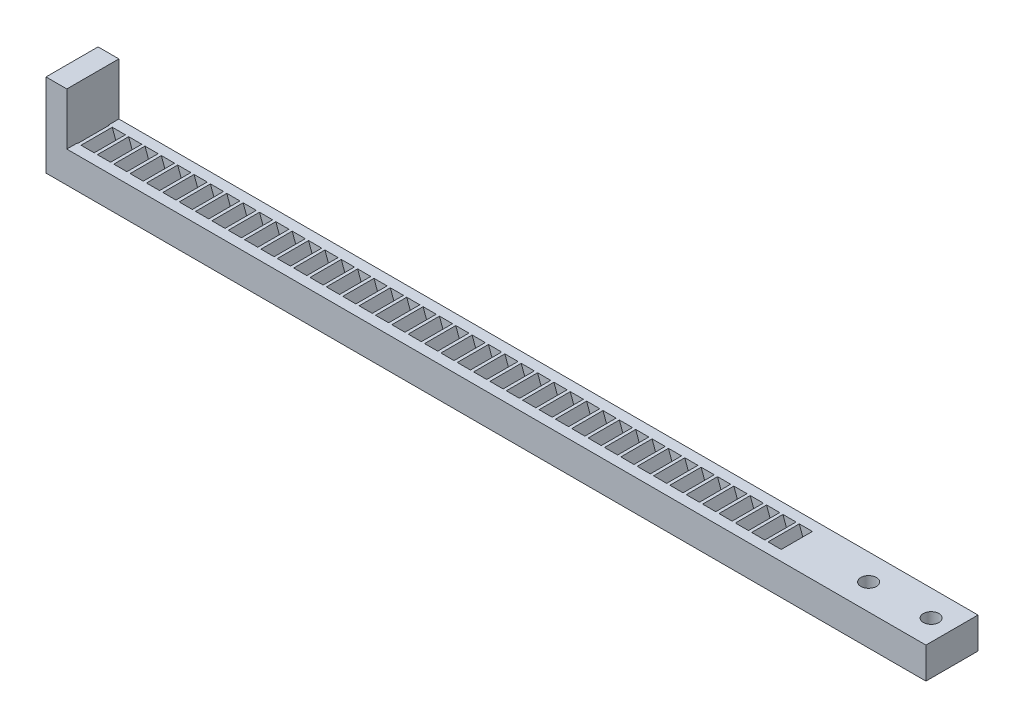
from build123d import *

# Parameters (mm, degrees)
BLANKSKE_W             = 185
BLANKSKE_H             = 6
BLANK_DEPTH            = 6
TOOTHCUTILL_DEPTH      = 186.194492359
TOOTHCUTSIM_DEPTH      = 186.194492359
PATTERN_LINEAR_1_COUNT = 50
PATTERN_LINEAR_1_PITCH = 3.14159265
SKETCH_3_W             = 6
SKETCH_3_H             = 6
CUT_EXTRUDE_1_DEPTH    = 16
SKETCH_2_W             = 2
SKETCH_2_H             = 6
EXTRUDE_2_DEPTH        = 169
CUT_EXTRUDE_2_DEPTH    = 150
SKETCH_5_W             = 10
SKETCH_5_H             = 16
EXTRUDE_3_DEPTH        = 4
SKETCH_6_R             = 1.5
CUT_EXTRUDE_3_DEPTH    = 186.442713526


with BuildPart() as part:
    # BlankSke → Blank (new body)
    with BuildSketch(Plane.XY):
        with Locations((92.5, 3)):
            Rectangle(BLANKSKE_W, BLANKSKE_H)
    extrude(amount=-BLANK_DEPTH)

    # TooCutSkeIll → ToothCutIll (cut, through all)
    with BuildSketch(Plane.XY):
        with BuildLine():
            Line((-1.253788993, 5.973680806), (-0.504546125, 3.915152944))
            ThreePointArc((-0.504546125, 3.915152944), (-0.412650963, 3.795392837), (-0.268683278, 3.75))
            Line((-0.268683278, 3.75), (0.268683278, 3.75))
            ThreePointArc((0.268683278, 3.75), (0.412650963, 3.795392837), (0.504546125, 3.915152944))
            Line((0.504546125, 3.915152944), (1.253788993, 5.973680806))
            ThreePointArc((1.253788993, 5.973680806), (1.268433641, 5.992766082), (1.291376698, 6))
            Line((1.291376698, 6), (1.291376698, 6.0254))
            Line((1.291376698, 6.0254), (-1.291376698, 6.0254))
            Line((-1.291376698, 6.0254), (-1.291376698, 6))
            ThreePointArc((-1.291376698, 6), (-1.268433641, 5.992766082), (-1.253788993, 5.973680806))
        make_face()
    extrude(amount=-TOOTHCUTILL_DEPTH, mode=Mode.SUBTRACT)

    # TooCutSkeSim → ToothCutSim (cut, through all)
    with BuildSketch(Plane.XY):
        Polygon((0.44443537, 3.75), (-0.44443537, 3.75), (-1.272613241, 6.0254), (1.272613241, 6.0254), align=None)
    toothcutsim = extrude(amount=-TOOTHCUTSIM_DEPTH, mode=Mode.SUBTRACT)

    # Линейный массив1: ToothCutSim ×50
    with Locations(*[(i * PATTERN_LINEAR_1_PITCH, 0, 0) for i in range(1, PATTERN_LINEAR_1_COUNT)]):
        add(toothcutsim, mode=Mode.SUBTRACT)

    # Эскиз3 → Вырез-Вытянуть1 (cut)
    with BuildSketch(Plane.ZY):
        with Locations((-3, 3)):
            Rectangle(SKETCH_3_W, SKETCH_3_H)
    extrude(amount=-CUT_EXTRUDE_1_DEPTH, mode=Mode.SUBTRACT)

    # Эскиз2 → Бобышка-Вытянуть2 (add)
    with BuildSketch(Plane(origin=(185, 0, 0), x_dir=(0, 0, -1), z_dir=(1, 0, 0))):
        with Locations((7, 3)):
            Rectangle(SKETCH_2_W, SKETCH_2_H)
        with Locations((-1, 3)):
            Rectangle(SKETCH_2_W, SKETCH_2_H)
    extrude(amount=-EXTRUDE_2_DEPTH)

    # Эскиз4 → Вырез-Вытянуть2 (cut)
    with BuildSketch(Plane.ZY.offset(-16)):
        with BuildLine():
            Line((-4.6, 1.6), (-4.6, 0))
            Line((-4.6, 0), (-1.4, 0))
            Line((-1.4, 0), (-1.4, 1.6))
            ThreePointArc((-1.4, 1.6), (-3, 3.2), (-4.6, 1.6))
        make_face()
    extrude(amount=-CUT_EXTRUDE_2_DEPTH, mode=Mode.SUBTRACT)

    # Эскиз5 → Бобышка-Вытянуть3 (add)
    with BuildSketch(Plane.ZY.offset(-16)):
        with Locations((-3, 8)):
            Rectangle(SKETCH_5_W, SKETCH_5_H)
    extrude(amount=-EXTRUDE_3_DEPTH)

    # Эскиз6 → Вырез-Вытянуть3 (cut, through all)
    with BuildSketch(Plane(origin=(0, 6, 0), x_dir=(1, 0, 0), z_dir=(0, 1, 0))):
        with Locations(Location((181, 3, 0), (0, 0, 180))):
            Circle(SKETCH_6_R)
        with Locations(Location((169, 3, 0), (0, 0, 180))):
            Circle(SKETCH_6_R)
    extrude(amount=-CUT_EXTRUDE_3_DEPTH, mode=Mode.SUBTRACT)


solid = part.part
